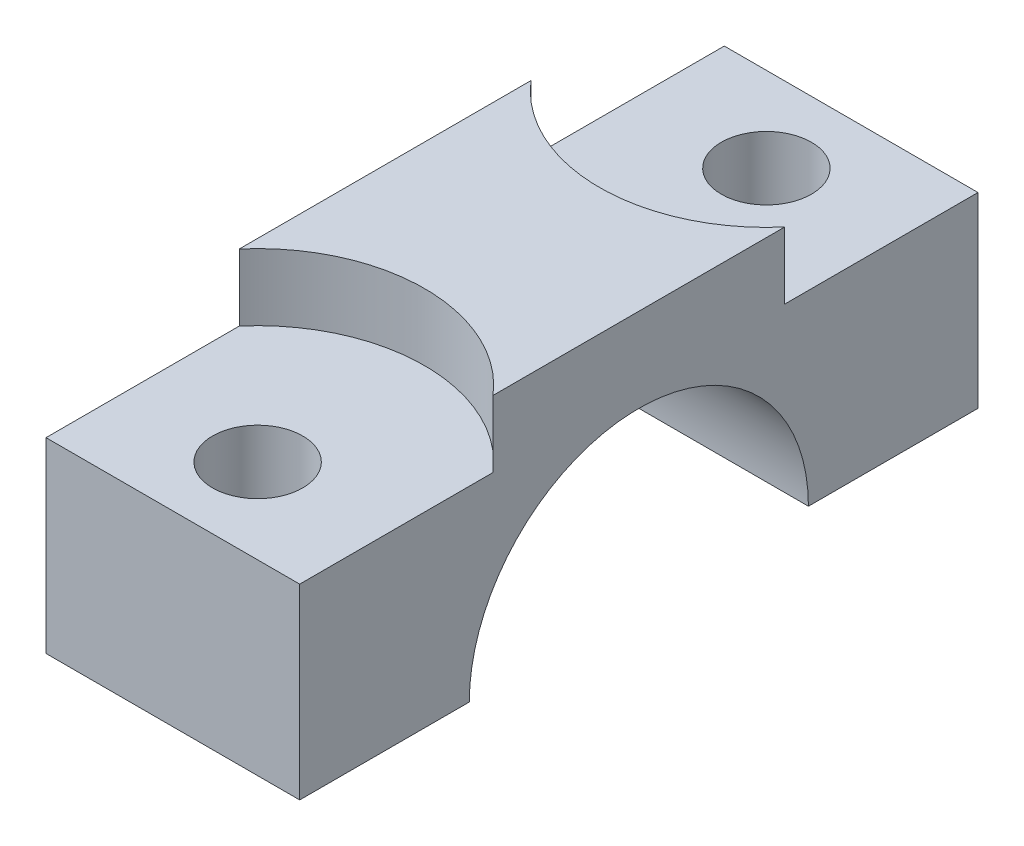
from build123d import *

# Parameters (mm, degrees)
BOSS_EXTRUDE1_DEPTH                           = 9.5
CBORE_FOR_M12_HEX_HEAD_CAP_SCREW2_D           = 6.75
CBORE_FOR_M12_HEX_HEAD_CAP_SCREW2_CBORE_D     = 25
CBORE_FOR_M12_HEX_HEAD_CAP_SCREW2_CBORE_DEPTH = 5


with BuildPart() as part:
    # Sketch1 → Boss-Extrude1 (new, symmetric)
    with BuildSketch(Plane(origin=(0, 0, 0), x_dir=(0, 0, -1), z_dir=(1, 0, 0))):
        with BuildLine():
            Line((12.7, 0), (25.4, 0))
            Line((25.4, 0), (25.4, 19))
            Line((25.4, 19), (-25.4, 19))
            Line((-25.4, 19), (-25.4, 0))
            Line((-25.4, 0), (-12.7, 0))
            ThreePointArc((-12.7, 0), (0, 12.7), (12.7, 0))
        make_face()
    extrude(amount=BOSS_EXTRUDE1_DEPTH, both=True)

    # CBORE for M12 Hex Head Cap Screw2 (through all)
    with Locations(Plane(origin=(0, 19, 19.05), x_dir=(0, 0, 1), z_dir=(0, 1, 0))):
        with Locations((0, 0), (-38.1, 0)):
            CounterBoreHole(CBORE_FOR_M12_HEX_HEAD_CAP_SCREW2_D / 2, CBORE_FOR_M12_HEX_HEAD_CAP_SCREW2_CBORE_D / 2, CBORE_FOR_M12_HEX_HEAD_CAP_SCREW2_CBORE_DEPTH)


solid = part.part
